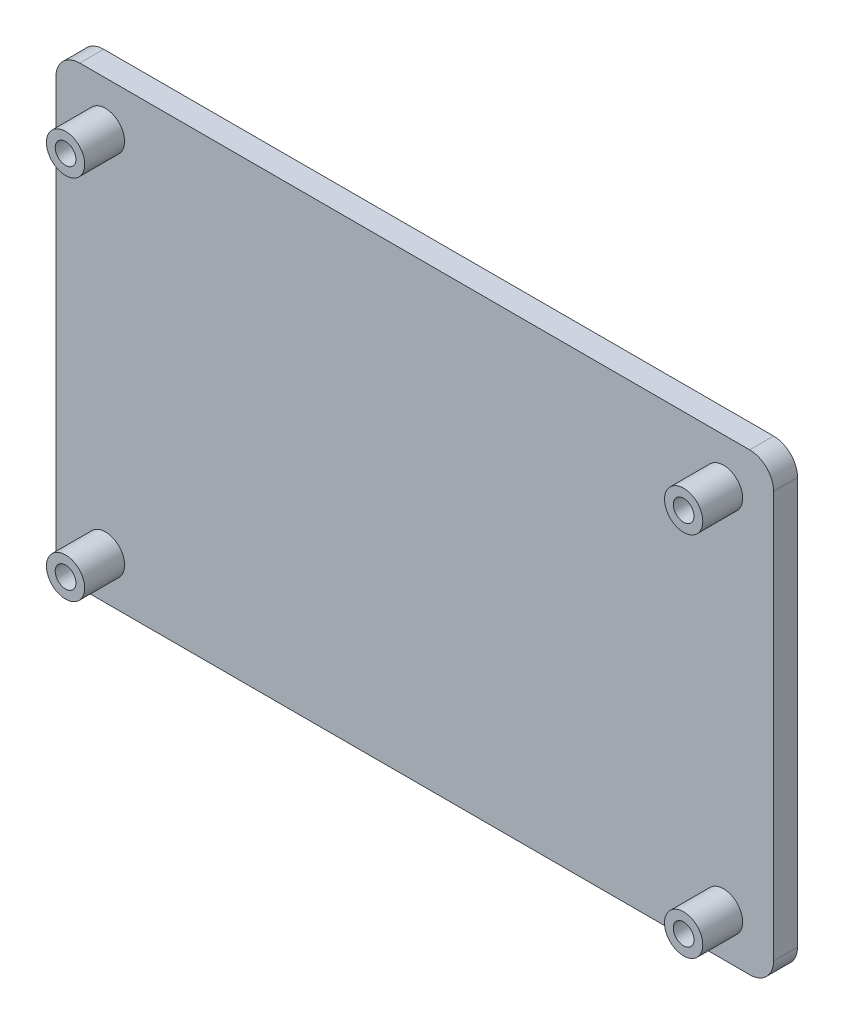
from build123d import *

# Parameters (mm, degrees)
SKETCH_3_R       = 2.4
SKETCH_3_R_2     = 1.3
EXTRUDE_5_DEPTH  = 5.000409789
SKETCH_3_8_R     = 2.4
SKETCH_3_8_R_2   = 1.3
EXTRUDE_6_DEPTH  = 5
SKETCH_3_9_R     = 2.4
SKETCH_3_9_R_2   = 1.3
EXTRUDE_7_DEPTH  = 5
SKETCH_3_10_R    = 2.4
SKETCH_3_10_R_2  = 1.3
EXTRUDE_8_DEPTH  = 5
EXTRUDE_START    = -3
SKETCH_3_17_R    = 1.3
EXTRUDE_12_DEPTH = 3


with BuildPart() as part:
    # 草图3 → 凸台-拉伸5 (new body)
    with BuildSketch(Plane.XY):
        with Locations((-40.5, 24)):
            Circle(SKETCH_3_R)
        with Locations((-40.5, 24)):
            Circle(SKETCH_3_R_2, mode=Mode.SUBTRACT)
    extrude(amount=EXTRUDE_5_DEPTH)



with BuildPart() as body_2:
    # 草图3<8> → 凸台-拉伸6 (new body)
    with BuildSketch(Plane.XY):
        with Locations((37, 24)):
            Circle(SKETCH_3_8_R)
        with Locations((37, 24)):
            Circle(SKETCH_3_8_R_2, mode=Mode.SUBTRACT)
    extrude(amount=EXTRUDE_6_DEPTH)


with BuildPart() as body_3:
    # 草图3<9> → 凸台-拉伸7 (new body)
    with BuildSketch(Plane.XY):
        with Locations((37, -22)):
            Circle(SKETCH_3_9_R)
        with Locations((37, -22)):
            Circle(SKETCH_3_9_R_2, mode=Mode.SUBTRACT)
    extrude(amount=EXTRUDE_7_DEPTH)


with BuildPart() as body_4:
    # 草图3<10> → 凸台-拉伸8 (new body)
    with BuildSketch(Plane.XY):
        with Locations((-40.5, -22)):
            Circle(SKETCH_3_10_R)
        with Locations((-40.5, -22)):
            Circle(SKETCH_3_10_R_2, mode=Mode.SUBTRACT)
    extrude(amount=EXTRUDE_8_DEPTH)


with BuildPart() as part_1:
    add(part.part)

    add(body_2.part)  # 凸台-拉伸12 merges body 2

    add(body_3.part)  # 凸台-拉伸12 merges body 3

    add(body_4.part)  # 凸台-拉伸12 merges body 4
    # 草图3<17> → 凸台-拉伸12 (add)
    with BuildSketch(Plane.XY.offset(EXTRUDE_START)):
        with BuildLine():
            Line((40.282145442, 29.703068159), (-43.717854558, 29.703068159))
            ThreePointArc((-43.717854558, 29.703068159), (-45.839174902, 28.824388502), (-46.717854558, 26.703068159))
            Line((-46.717854558, 26.703068159), (-46.717854558, -24.296931841))
            ThreePointArc((-46.717854558, -24.296931841), (-45.839174902, -26.418252185), (-43.717854558, -27.296931841))
            Line((-43.717854558, -27.296931841), (40.282145442, -27.296931841))
            ThreePointArc((40.282145442, -27.296931841), (42.403465785, -26.418252185), (43.282145442, -24.296931841))
            Line((43.282145442, -24.296931841), (43.282145442, 26.703068159))
            ThreePointArc((43.282145442, 26.703068159), (42.403465785, 28.824388502), (40.282145442, 29.703068159))
        make_face()
        with Locations((-40.5, -22)):
            Circle(SKETCH_3_17_R, mode=Mode.SUBTRACT)
        with Locations((37, -22)):
            Circle(SKETCH_3_17_R, mode=Mode.SUBTRACT)
        with Locations((-40.5, 24)):
            Circle(SKETCH_3_17_R, mode=Mode.SUBTRACT)
        with Locations((37, 24)):
            Circle(SKETCH_3_17_R, mode=Mode.SUBTRACT)
    extrude(amount=EXTRUDE_12_DEPTH)


solid = part_1.part
